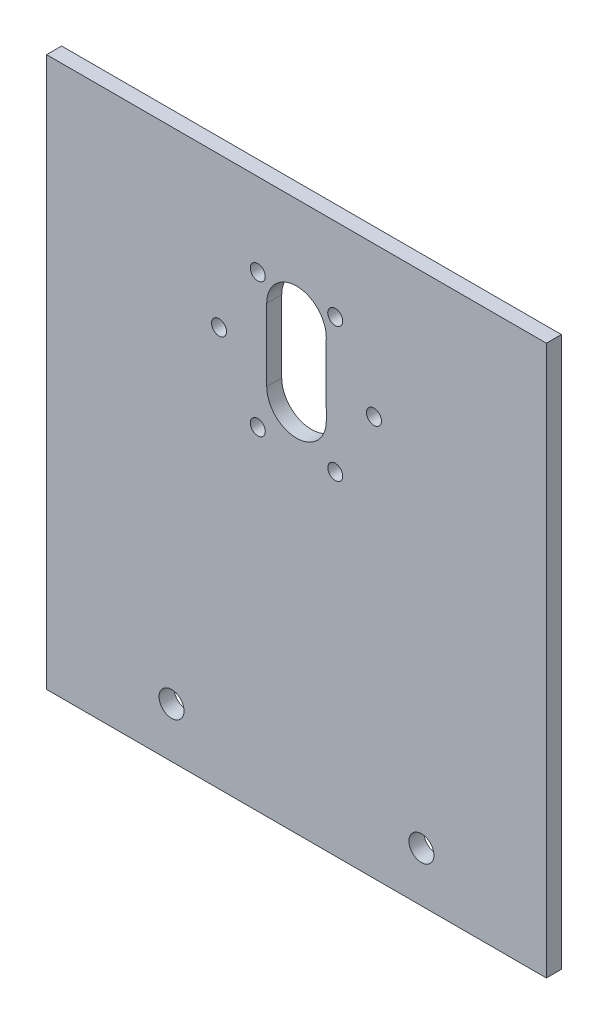
from build123d import *

# Parameters (mm, degrees)
SKETCH1_W           = 100
SKETCH1_H           = 110
SKETCH1_R           = 2.5
SKETCH1_R_2         = 1.5
BOSS_EXTRUDE1_DEPTH = 3


with BuildPart() as part:
    # Sketch1 → Boss-Extrude1 (new body)
    with BuildSketch(Plane.XY):
        Rectangle(SKETCH1_W, SKETCH1_H)
        with Locations((-25, -45)):
            Circle(SKETCH1_R, mode=Mode.SUBTRACT)
        with Locations((25, -45)):
            Circle(SKETCH1_R, mode=Mode.SUBTRACT)
        with Locations((-15.5, 24.997203367)):
            Circle(SKETCH1_R_2, mode=Mode.SUBTRACT)
        with Locations((-7.752421955, 38.421995442)):
            Circle(SKETCH1_R_2, mode=Mode.SUBTRACT)
        with Locations((7.747578045, 38.424792075)):
            Circle(SKETCH1_R_2, mode=Mode.SUBTRACT)
        with Locations((15.5, 25.002796633)):
            Circle(SKETCH1_R_2, mode=Mode.SUBTRACT)
        with Locations((7.752421955, 11.578004558)):
            Circle(SKETCH1_R_2, mode=Mode.SUBTRACT)
        with Locations((-7.747578045, 11.575207925)):
            Circle(SKETCH1_R_2, mode=Mode.SUBTRACT)
        with BuildLine():
            Line((5.910876507, 33.185052569), (5.959490464, 19.526769566))
            ThreePointArc((5.959490464, 19.526769566), (0.010605831, 13.546039163), (-5.959528213, 19.505557938))
            Line((-5.959528213, 19.505557938), (-5.959528213, 33.944996934))
            ThreePointArc((-5.959528213, 33.944996934), (0.380750058, 39.892349783), (5.910876507, 33.185052569))
        make_face(mode=Mode.SUBTRACT)
    extrude(amount=BOSS_EXTRUDE1_DEPTH)


solid = part.part
